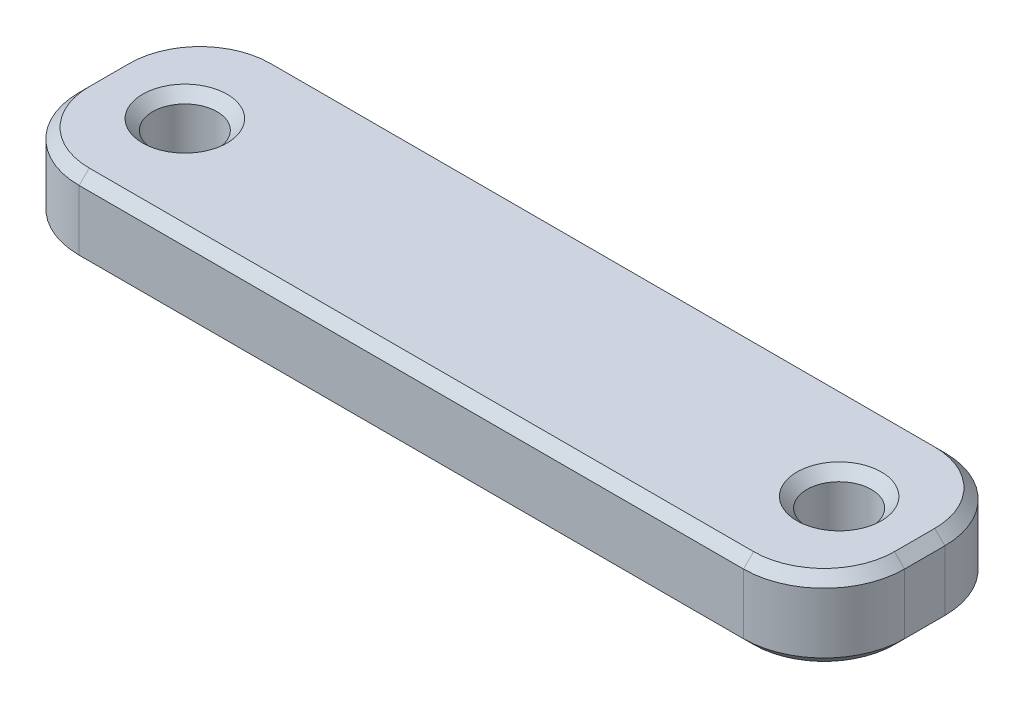
from build123d import *

# Parameters (mm, degrees)
SKETCH1_W           = 41
SKETCH1_H           = 10
SKETCH1_R           = 1.6
BOSS_EXTRUDE1_DEPTH = 4
FILLET1_R           = 4
CHAMFER1_SIZE       = 0.5


with BuildPart() as part:
    # Sketch1 → Boss-Extrude1 (new body)
    with BuildSketch(Plane(origin=(0, 0, 0), x_dir=(1, 0, 0), z_dir=(0, 1, 0))):
        Rectangle(SKETCH1_W, SKETCH1_H)
        with Locations(Location((-16.25, 0, 0), (0, 0, 270))):
            Circle(SKETCH1_R, mode=Mode.SUBTRACT)
        with Locations(Location((16.25, 0, 0), (0, 0, 270))):
            Circle(SKETCH1_R, mode=Mode.SUBTRACT)
    extrude(amount=BOSS_EXTRUDE1_DEPTH)

    # Fillet1
    fillet1_edges = [part.edges().sort_by_distance(p)[0] for p in [
        (20.5, 2, 5),
        (-20.5, 2, 5),
        (-20.5, 2, -5),
        (20.5, 2, -5),
    ]]
    fillet(fillet1_edges, radius=FILLET1_R)

    # Chamfer1
    chamfer1_edges = [part.edges().sort_by_distance(p)[0] for p in [
        (-16.25, 0, -1.6),
        (-16.25, 4, -1.6),
        (16.25, 0, -1.6),
        (16.25, 4, -1.6),
        (0, 0, -5),
        (0, 4, -5),
        (20.5, 0, 0),
        (0, 0, 5),
        (-20.5, 0, 0),
        (-19.328427125, 0, -3.828427125),
        (-19.328427125, 0, 3.828427125),
        (19.328427125, 0, 3.828427125),
        (19.328427125, 0, -3.828427125),
        (20.5, 4, 0),
        (-20.5, 4, 0),
        (0, 4, 5),
        (-19.328427125, 4, -3.828427125),
        (-19.328427125, 4, 3.828427125),
        (19.328427125, 4, 3.828427125),
        (19.328427125, 4, -3.828427125),
    ]]
    chamfer(chamfer1_edges, length=CHAMFER1_SIZE)


solid = part.part
